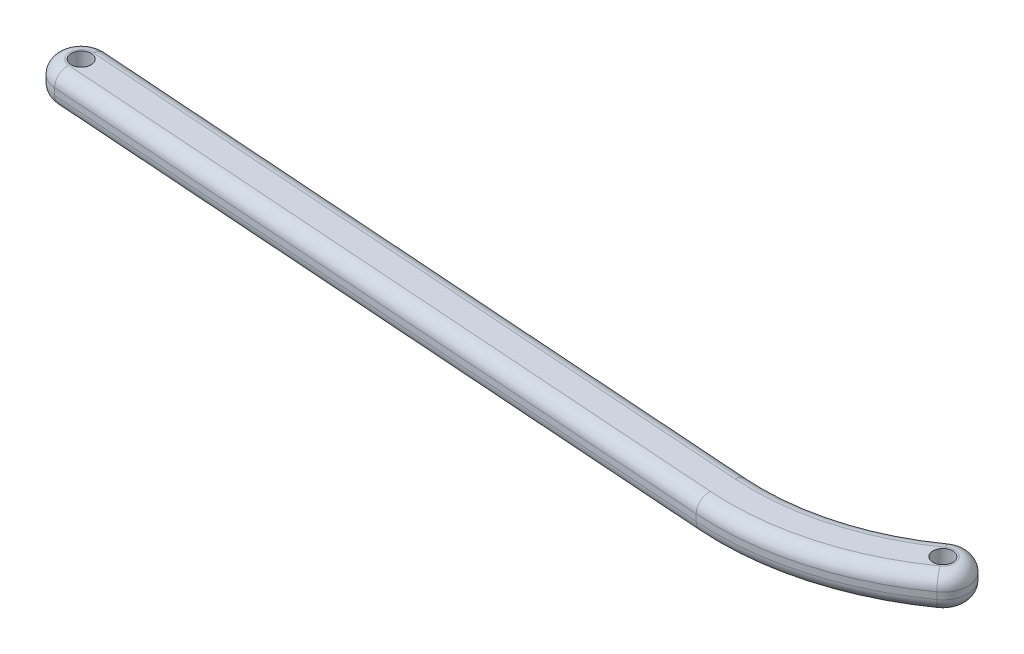
from build123d import *

# Parameters (mm, degrees)
CROQUIS1_R              = 3
SALIENTE_EXTRUIR1_DEPTH = 5
REDONDEO7_R             = 4


with BuildPart() as part:
    # Croquis1 → Saliente-Extruir1 (new, symmetric)
    with BuildSketch(Plane(origin=(0, 0, 0), x_dir=(-1, 0, 0), z_dir=(0, 1, 0))):
        with BuildLine():
            Line((52.388821078, 22.035902101), (260.523173553, 7.481730377))
            ThreePointArc((260.523173553, 7.481730377), (267.481730377, -0.523173553), (259.476826447, -7.481730377))
            Line((259.476826447, -7.481730377), (51.342473972, 7.072441348))
            ThreePointArc((51.342473972, 7.072441348), (26.697288319, 4.552818898), (4.339230902, -6.117276778))
            ThreePointArc((4.339230902, -6.117276778), (-6.117276778, -4.339230902), (-4.339230902, 6.117276778))
            ThreePointArc((-4.339230902, 6.117276778), (22.644631497, 18.994978455), (52.388821078, 22.035902101))
        make_face()
        with Locations(Location((0, 0, 0), (0, 0, 90))):
            Circle(CROQUIS1_R, mode=Mode.SUBTRACT)
        with Locations(Location((260, 0, 0), (0, 0, 90))):
            Circle(CROQUIS1_R, mode=Mode.SUBTRACT)
    extrude(amount=SALIENTE_EXTRUIR1_DEPTH, both=True)

    # Redondeo7
    redondeo7_edges = [part.edges().sort_by_distance(p)[0] for p in [
        (-155.409650209, 5, -0.204644515),
        (-267.481730377, 5, -0.523173553),
        (-156.455997315, 5, 14.758816239),
        (-22.644631497, 5, 18.994978455),
        (6.117276778, 5, -4.339230902),
        (-22.644631497, -5, 18.994978455),
        (-156.455997315, -5, 14.758816239),
        (-267.481730377, -5, -0.523173553),
        (-155.409650209, -5, -0.204644515),
        (-26.697288319, -5, 4.552818898),
        (6.117276778, -5, -4.339230902),
        (-26.697288319, 5, 4.552818898),
    ]]
    fillet(redondeo7_edges, radius=REDONDEO7_R)


solid = part.part
